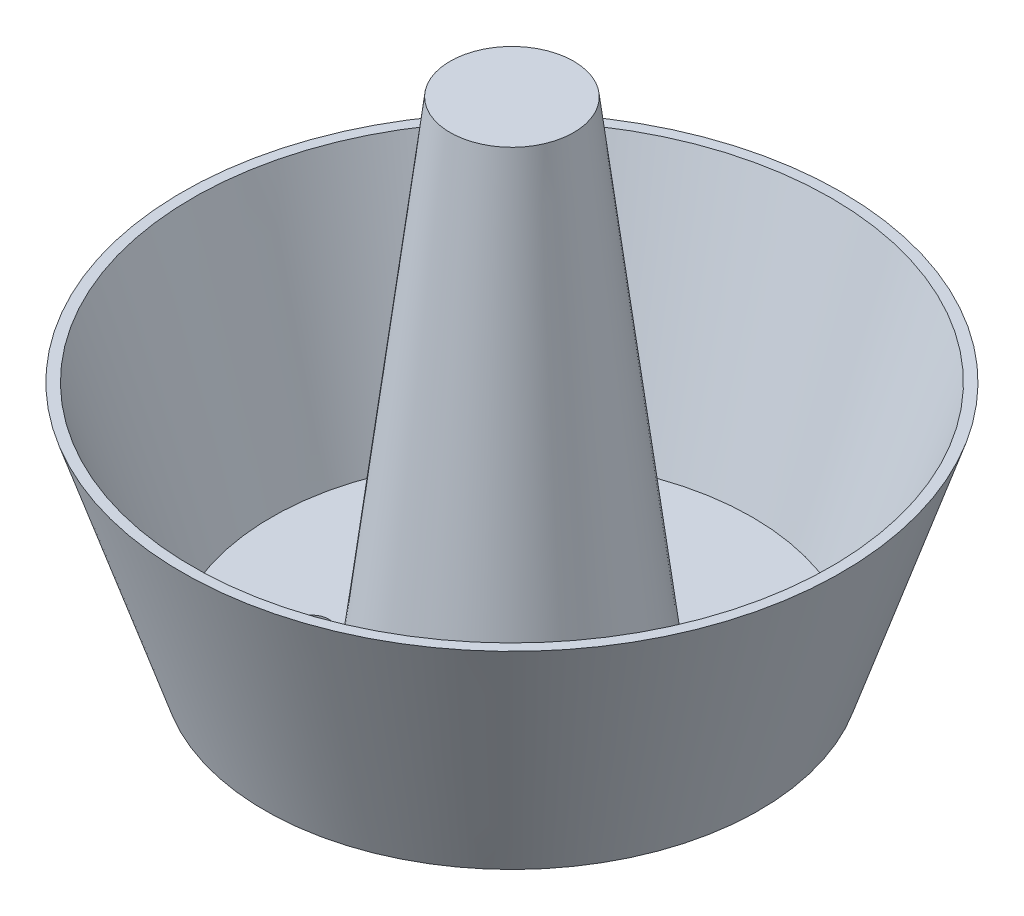
from build123d import *

# Parameters (mm, degrees)
F_3_8_CLEARANCE_HOLE1_D = 10.0838
SKETCH2_R               = 12.7
RF_CONNECTOR_DEPTH      = 25.4


with BuildPart() as part:
    # Sketch1 → Revolve1 (revolve)
    with BuildSketch(Plane.XY, mode=Mode.PRIVATE) as revolve1_sk:
        Polygon((0, 152.4), (19.05, 152.4), (37.34122006, 3.175), (74.083333333, 3.175), (98.425, 76.2), (101.6, 76.2), (76.2, 0), (0, 0), align=None)
    revolve(revolve1_sk.sketch.rotate(Axis((0, 0, 0), (0, 1, 0)), 90), axis=Axis((0, 0, 0), (0, 1, 0)))

    # 3/8 Clearance Hole1 (through all)
    with Locations(Plane(origin=(0, 0, 0), x_dir=(-1, 0, 0), z_dir=(0, -1, 0))):
        with Locations((38.1, -23.493790612), (-38.1, -23.493790612)):
            Hole(F_3_8_CLEARANCE_HOLE1_D / 2)

    # Sketch2 → RF Connector (add)
    with BuildSketch(Plane.XZ):
        with Locations(Location((0, 0, 0), (0, 0, 270))):
            Circle(SKETCH2_R)
    extrude(amount=RF_CONNECTOR_DEPTH)


solid = part.part
